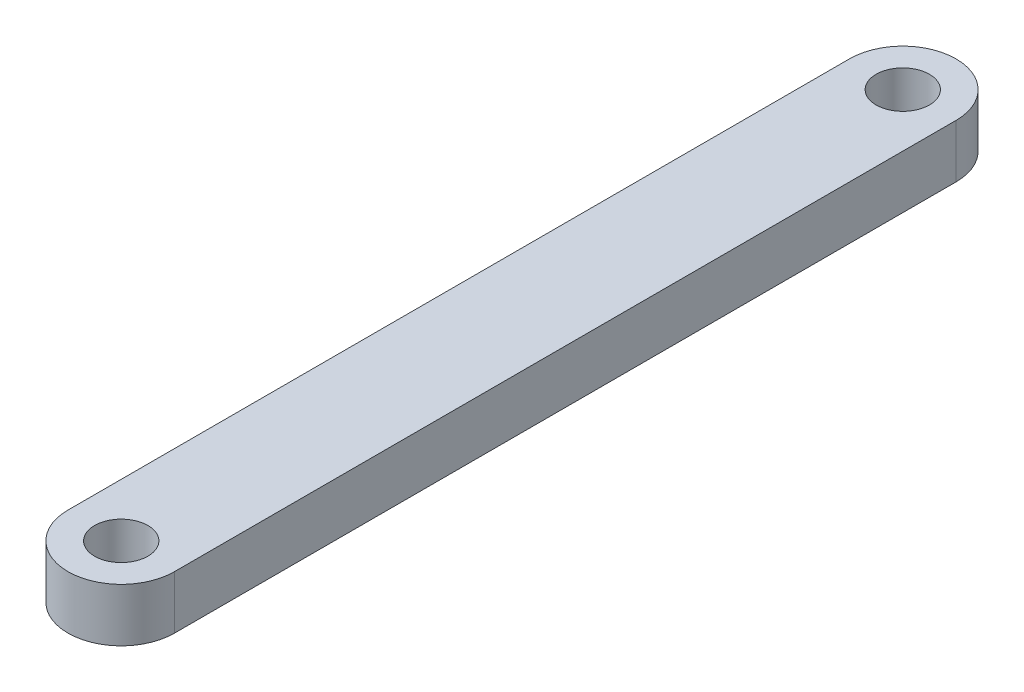
from build123d import *

# Parameters (mm, degrees)
ESQUISSE1_R        = 1.5
BOSS_EXTRU_1_DEPTH = 3


with BuildPart() as part:
    # Esquisse1 → Boss.-Extru.1 (new body)
    with BuildSketch(Plane(origin=(0, 0, 0), x_dir=(1, 0, 0), z_dir=(0, 1, 0))):
        with BuildLine():
            Line((-3, 0), (-3, -44))
            ThreePointArc((-3, -44), (0, -47), (3, -44))
            Line((3, -44), (3, 0))
            ThreePointArc((3, 0), (0, 3), (-3, 0))
        make_face()
        with Locations(Location((0, 0, 0), (0, 0, 270))):
            Circle(ESQUISSE1_R, mode=Mode.SUBTRACT)
        with Locations(Location((0, -44, 0), (0, 0, 90))):
            Circle(ESQUISSE1_R, mode=Mode.SUBTRACT)
    extrude(amount=BOSS_EXTRU_1_DEPTH)


solid = part.part
